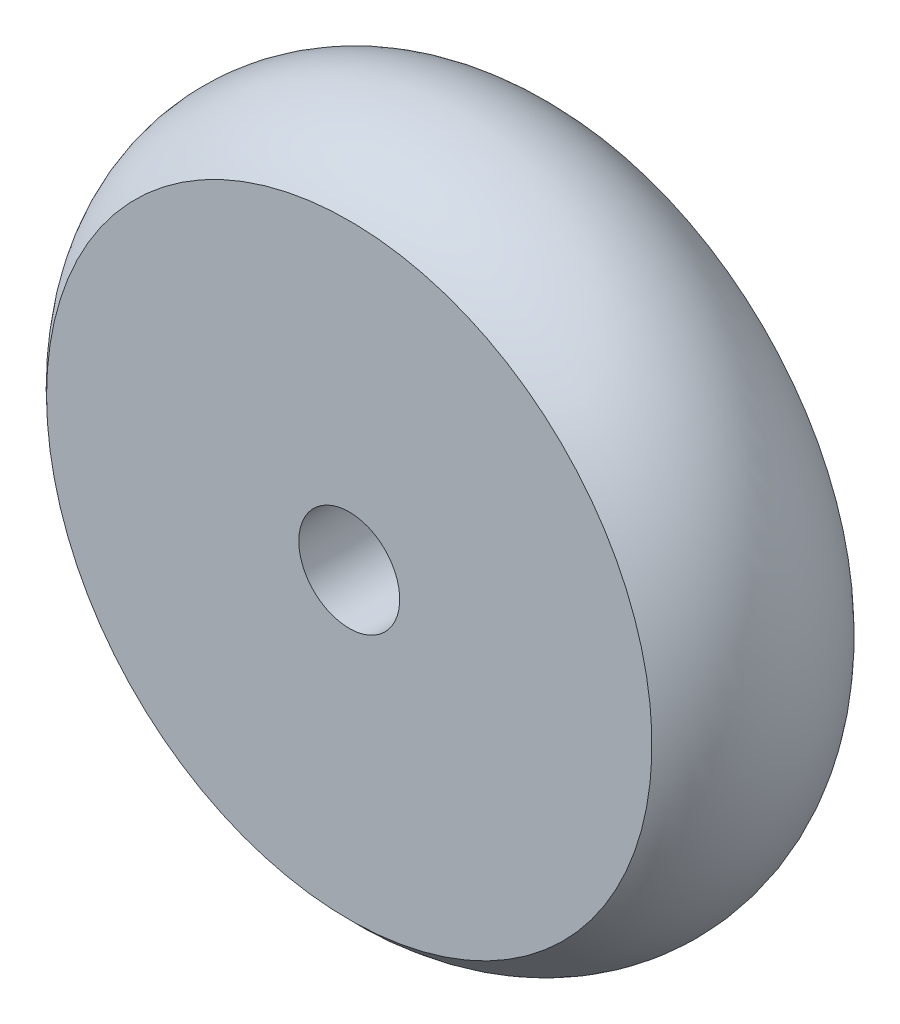
from build123d import *


with BuildPart() as part:
    # Эскиз1 → Повернуть2 (revolve)
    with BuildSketch(Plane(origin=(0, 0, 0), x_dir=(1, 0, 0), z_dir=(0, 1, 0))):
        with BuildLine():
            Line((-4.5, -3), (-0.75, -3))
            Line((-0.75, -3), (-0.75, -1))
            Line((-0.75, -1), (0, -1))
            Line((0, -1), (0, 0))
            Line((0, 0), (-4.5, 0))
            ThreePointArc((-4.5, 0), (-5.177124344, -1.5), (-4.5, -3))
        make_face()
    revolve(axis=Axis((0, 0, 0), (0, 0, 1)))


solid = part.part
